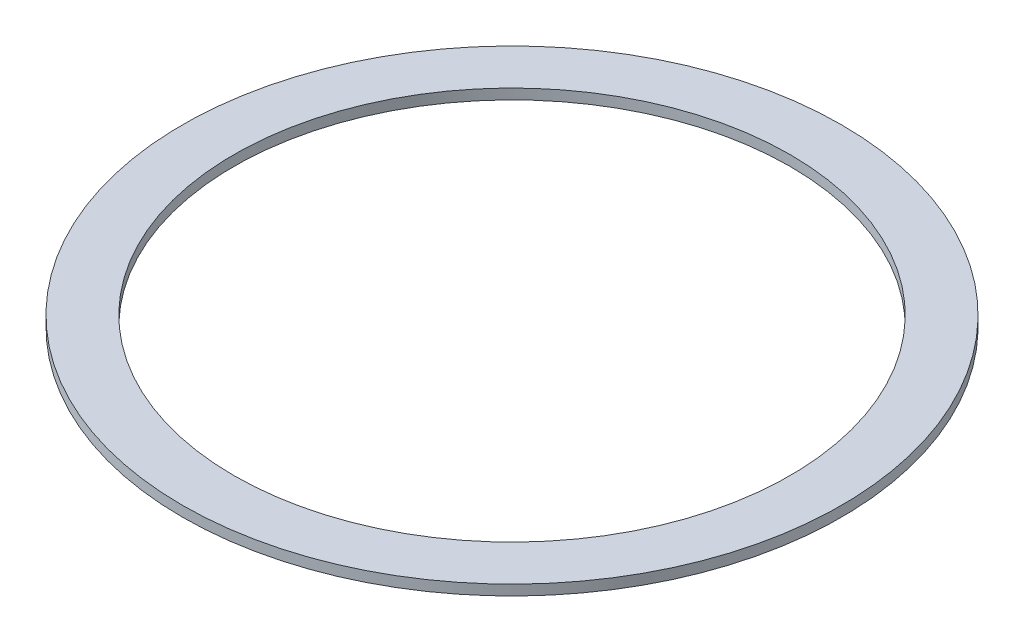
from build123d import *

# Parameters (mm, degrees)
ESBO_O1_R                = 48
ESBO_O1_R_2              = 40.5
RESSALTO_EXTRUS_O1_DEPTH = 1.5


with BuildPart() as part:
    # Esboço1 → Ressalto-extrusão1 (new body)
    with BuildSketch(Plane(origin=(0, 0, 0), x_dir=(1, 0, 0), z_dir=(0, 1, 0))):
        with Locations(Location((0, 0, 0), (0, 0, 270))):
            Circle(ESBO_O1_R)
        with Locations(Location((0, 0, 0), (0, 0, 270))):
            Circle(ESBO_O1_R_2, mode=Mode.SUBTRACT)
    extrude(amount=RESSALTO_EXTRUS_O1_DEPTH)


solid = part.part
